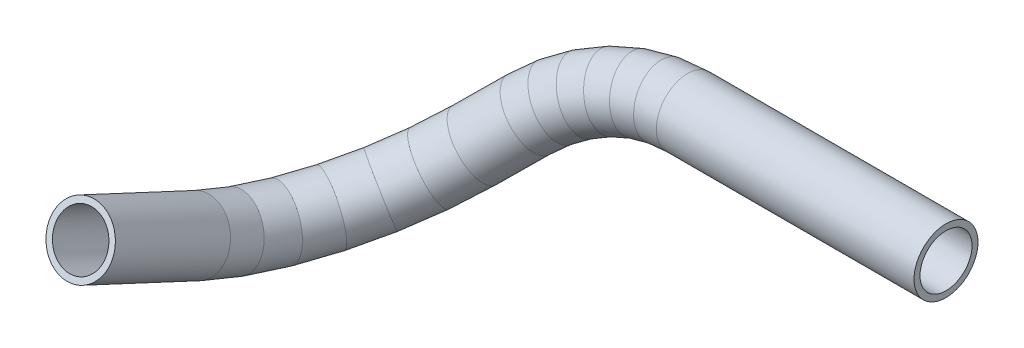
from build123d import *

# Parameters (mm, degrees)
PROFILE_R   = 4.7625
PROFILE_R_2 = 3.8735


with BuildPart() as part:
    # Tube: sweep along a curve in space
    with BuildLine() as tube_path:
        Line((34.8, 56.886703457, -67.794933216), (-3.658830738, 56.886703457, -67.794933216))
        Line((-3.658830738, 56.886703457, -67.794933216), (-7.177671109, 56.677291419, -67.64190816))
        Line((-7.177671109, 56.677291419, -67.64190816), (-10.620456219, 56.05358148, -67.186140434))
        Line((-10.620456219, 56.05358148, -67.186140434), (-13.912774646, 55.029054336, -66.437480878))
        Line((-13.912774646, 55.029054336, -66.437480878), (-16.983467114, 53.62585384, -65.412110816))
        Line((-16.983467114, 53.62585384, -65.412110816), (-19.766164508, 51.874308385, -64.132192319))
        Line((-19.766164508, 51.874308385, -64.132192319), (-22.200722363, 49.812275401, -62.625389198))
        Line((-22.200722363, 49.812275401, -62.625389198), (-26.892627421, 45.202662211, -59.256975793))
        Line((-26.892627421, 45.202662211, -59.256975793), (-30.402939092, 42.040161338, -56.123001981))
        Line((-30.402939092, 42.040161338, -56.123001981), (-33.588772762, 39.752958781, -52.028534988))
        Line((-33.588772762, 39.752958781, -52.028534988), (-36.272332962, 38.468699075, -47.202079423))
        Line((-36.272332962, 38.468699075, -47.202079423), (-38.303855175, 38.25905437, -41.91299082))
        Line((-38.303855175, 38.25905437, -41.91299082), (-39.569963915, 39.13572455, -36.456443402))
        Line((-39.569963915, 39.13572455, -36.456443402), (-40, 41.049784277, -31.136956962))
        Line((-40, 41.049784277, -31.136956962), (-40, 49.145388181, -13.775878363))
    # Profile → Tube (sweep)
    with BuildSketch(Plane(origin=(34.8, 0, 0), x_dir=(0, 0, -1), z_dir=(1, 0, 0))):
        with Locations((67.794933216, 56.886703457)):
            Circle(PROFILE_R)
        with Locations((67.794933216, 56.886703457)):
            Circle(PROFILE_R_2, mode=Mode.SUBTRACT)
    sweep(path=tube_path.line, transition=Transition.RIGHT)


solid = part.part
